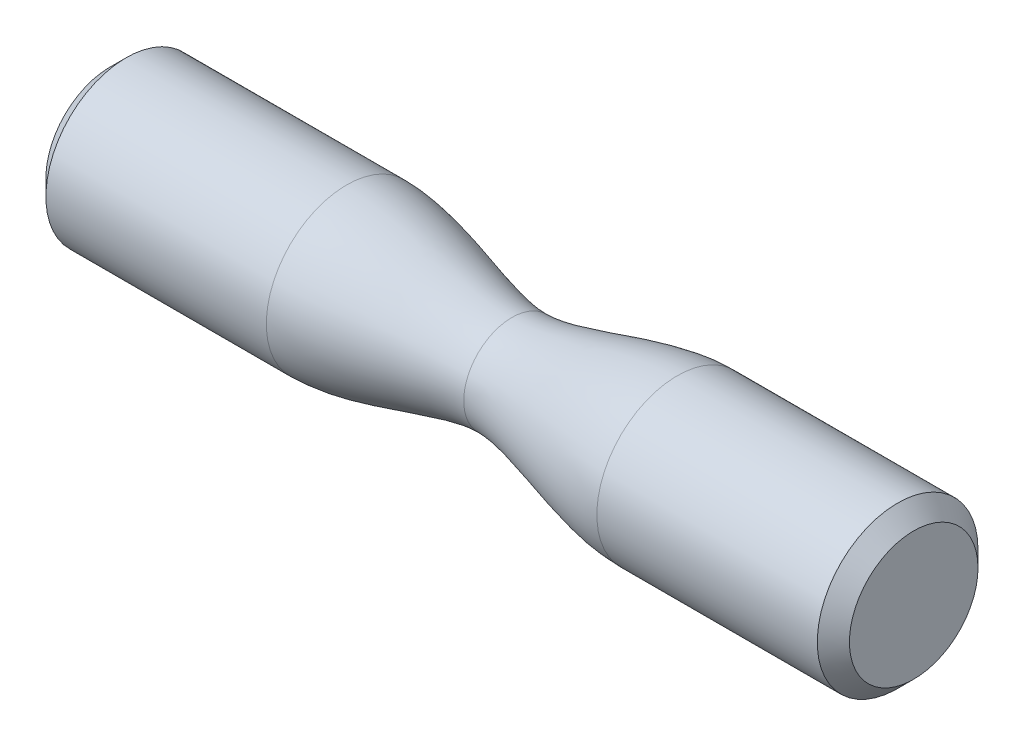
from build123d import *

# Parameters (mm, degrees)
EXTRUDE1_DEPTH      = 7.9375
EXTRUDE1_DEPTH_BACK = 7.9375
SKETCH2_R           = 1.5875
CHAMFER1_SIZE       = 0.3175


with BuildPart() as part:
    # Sketch2 → Extrude1 (new, two sides: drawn at the far end of the back side and taken through both)
    with BuildSketch(Plane(origin=(0, 0, 0), x_dir=(0, 0, -1), z_dir=(1, 0, 0)).offset(-EXTRUDE1_DEPTH_BACK)):
        Circle(SKETCH2_R)
    extrude(amount=EXTRUDE1_DEPTH + EXTRUDE1_DEPTH_BACK)

    # Chamfer1
    chamfer1_edges = [part.edges().sort_by_distance(p)[0] for p in [
        (-7.9375, 0, 1.5875),
        (7.9375, 0, 1.5875),
    ]]
    chamfer(chamfer1_edges, length=CHAMFER1_SIZE)

    # Sketch3 → Cut-Revolve1 (revolve, cut)
    with BuildSketch(Plane.XY, mode=Mode.PRIVATE) as cut_revolve1_sk:
        with BuildLine():
            Line((3.265089056, 1.5875), (-3.265089056, 1.5875))
            add(Edge.make_bspline(
                [(-3.265089056, 1.5875), (-2.114433092, 1.5875), (-0.878501649, 0.9525), (0, 0.9525)],
                knots=[0, 0, 0, 0, 1, 1, 1, 1], degree=3))
            add(Edge.make_bspline(
                [(3.265089056, 1.5875), (2.114433092, 1.5875), (0.878501649, 0.9525), (0, 0.9525)],
                knots=[0, 0, 0, 0, 1, 1, 1, 1], degree=3))
        make_face()
    revolve(cut_revolve1_sk.sketch.rotate(Axis((7.9375, 0, 0), (-1, 0, 0)), 90), axis=Axis((7.9375, 0, 0), (-1, 0, 0)), mode=Mode.SUBTRACT)


solid = part.part
